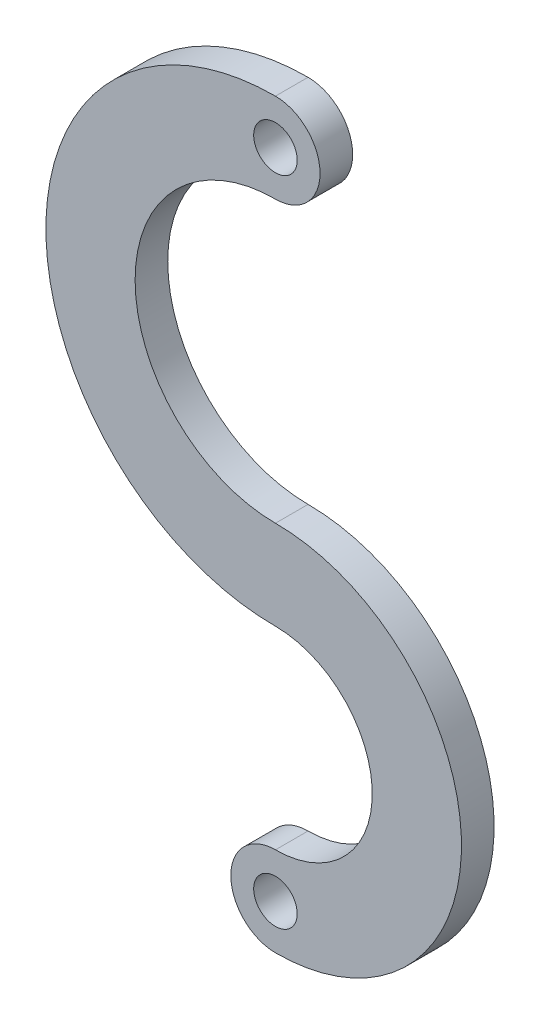
from build123d import *

# Parameters (mm, degrees)
SKETCH1_R           = 1
BOSS_EXTRUDE1_DEPTH = 1.5


with BuildPart() as part:
    # Sketch1 → Boss-Extrude1 (new body)
    with BuildSketch(Plane.XY):
        with BuildLine():
            ThreePointArc((0, 3.458652708), (-10.55, -7.091347292), (0, -17.641347292))
            ThreePointArc((0, -17.641347292), (4.45, -22.091347292), (0, -26.541347292))
            ThreePointArc((0, -26.541347292), (-2.05, -28.591347292), (0, -30.641347292))
            ThreePointArc((0, -30.641347292), (8.55, -22.091347292), (0, -13.541347292))
            ThreePointArc((0, -13.541347292), (-6.45, -7.091347292), (0, -0.641347292))
            ThreePointArc((0, -0.641347292), (2.05, 1.408652708), (0, 3.458652708))
        make_face()
        with Locations((0, 1.408652708)):
            Circle(SKETCH1_R, mode=Mode.SUBTRACT)
        with Locations((0, -28.591347292)):
            Circle(SKETCH1_R, mode=Mode.SUBTRACT)
    extrude(amount=BOSS_EXTRUDE1_DEPTH)


solid = part.part
